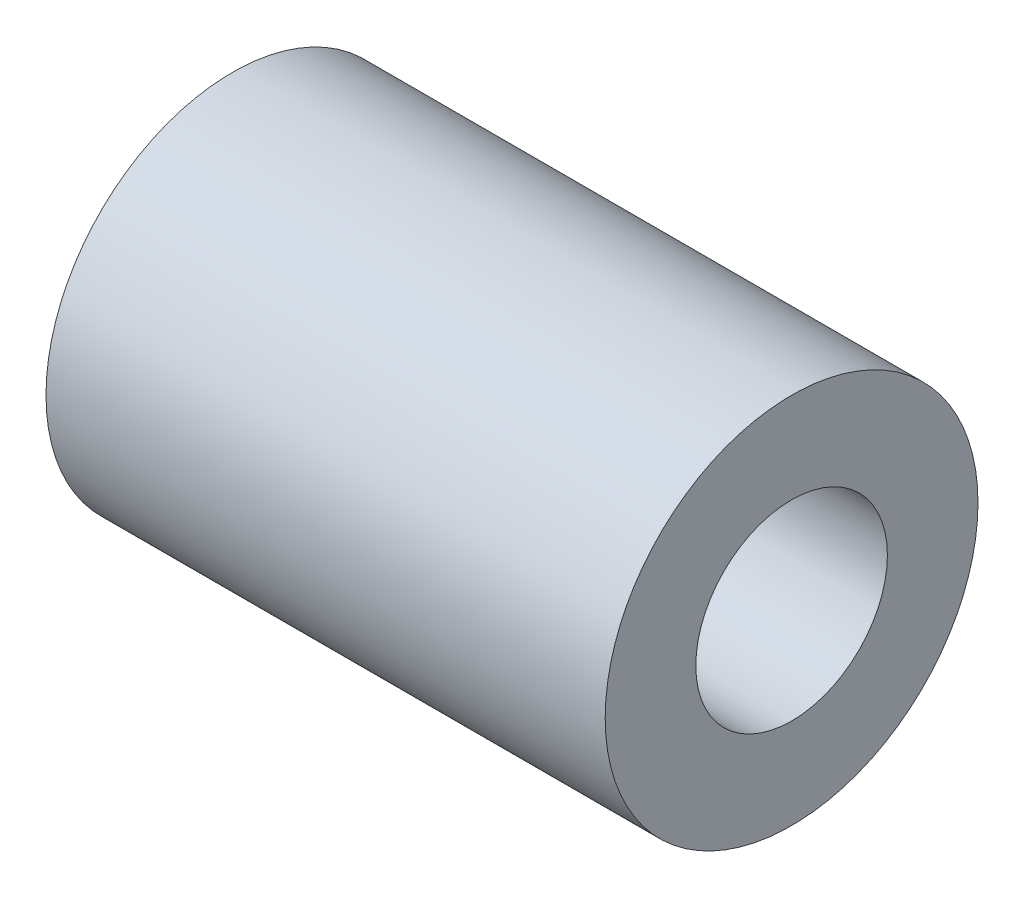
from build123d import *

# Parameters (mm, degrees)
SKETCH1_R           = 6.35
SKETCH1_R_2         = 3.2639
BOSS_EXTRUDE1_DEPTH = 19.05


with BuildPart() as part:
    # Sketch1 → Boss-Extrude1 (new body)
    with BuildSketch(Plane(origin=(0, 0, 0), x_dir=(0, 0, -1), z_dir=(1, 0, 0))):
        with Locations(Location((0, 0, 0), (0, 0, 180))):
            Circle(SKETCH1_R)
        with Locations(Location((0, 0, 0), (0, 0, 180))):
            Circle(SKETCH1_R_2, mode=Mode.SUBTRACT)
    extrude(amount=BOSS_EXTRUDE1_DEPTH)


solid = part.part
